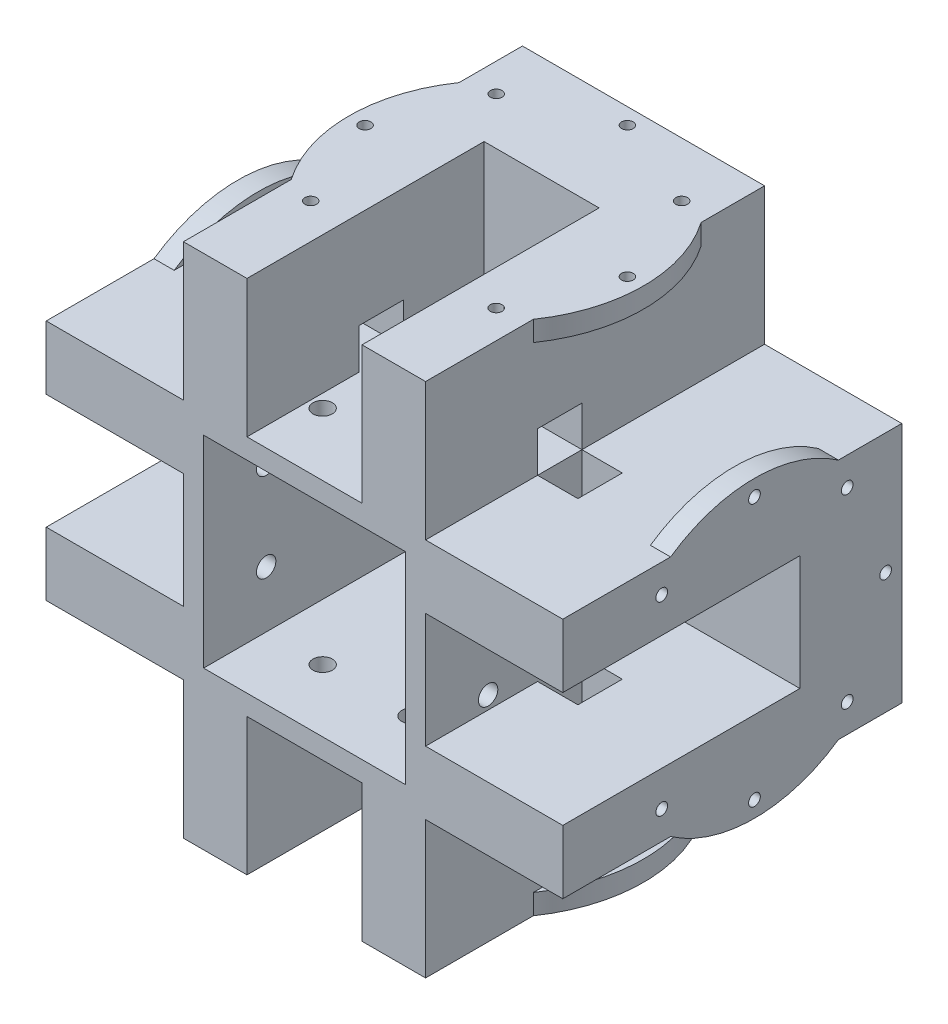
from build123d import *

# Parameters (mm, degrees)
SKETCH_1_W                = 60
SKETCH_1_H                = 60
SKETCH_1_W_2              = 50
SKETCH_1_H_2              = 50
EXTRUDE_1_DEPTH           = 84
EXTRUDE_2_DEPTH           = 34
EXTRUDE_5_DEPTH           = 34
EXTRUDE_6_DEPTH           = 34
EXTRUDE_7_DEPTH           = 34
SKETCH_12_R               = 36.5
EXTRUDE_8_DEPTH           = 5
EXTRUDE_START             = -5
SKETCH_13_R               = 36.5
EXTRUDE_9_DEPTH           = 5
SKETCH_14_R               = 36.5
EXTRUDE_10_DEPTH          = 5
SKETCH_15_R               = 36.5
EXTRUDE_11_DEPTH          = 5
SKETCH_22_W               = 29
SKETCH_22_H               = 28.5
SKETCH_22_W_2             = 28.5
SKETCH_22_H_2             = 29
EXTRUDE_12_DEPTH          = 60
SKETCH_18_R               = 1.45
CUT_EXTRUDE_2_DEPTH       = 5
PATTERN_CIRCULAR_1_COUNT  = 8
SKETCH_19_R               = 1.45
CUT_EXTRUDE_3_DEPTH       = 5
PATTERN_CIRCULAR_2_COUNT  = 8
CUT_EXTRUDE_START         = -5
SKETCH_20_R               = 1.45
CUT_EXTRUDE_4_DEPTH       = 5
PATTERN_CIRCULAR_3_COUNT  = 8
SKETCH_21_R               = 1.45
CUT_EXTRUDE_5_DEPTH       = 5
PATTERN_CIRCULAR_4_COUNT  = 8
SKETCH_26_W               = 34
SKETCH_26_H               = 28.5
SKETCH_26_W_2             = 28.5
SKETCH_26_H_2             = 34
CUT_EXTRUDE_7_DEPTH       = 58.75
SKETCH_27_R               = 10.5
CUT_EXTRUDE_8_DEPTH       = 200
SKETCH_28_R               = 10.5
CUT_EXTRUDE_9_DEPTH       = 200
SKETCH_31_R               = 2.4
CUT_EXTRUDE_12_DEPTH      = 200
SKETCH_32_R               = 2.4
CUT_EXTRUDE_13_DEPTH      = 200
CUT_EXTRUDE_14_DEPTH      = 50
CUT_EXTRUDE_14_DEPTH_BACK = 40
SKETCH_33_W               = 11
SKETCH_33_H               = 10
CUT_EXTRUDE_15_DEPTH      = 60
CUT_EXTRUDE_15_DEPTH_BACK = 40
SKETCH_34_W               = 10
SKETCH_34_H               = 11
SKETCH_35_W               = 11
SKETCH_35_H               = 10
CUT_EXTRUDE_16_DEPTH      = 80
SKETCH_36_W               = 10
SKETCH_36_H               = 11
CUT_EXTRUDE_17_DEPTH      = 80


with BuildPart() as part:
    # 草图1 → 拉伸-薄壁1 (new body)
    with BuildSketch(Plane.XY):
        with Locations((-65.869565217, 24.858695652)):
            Rectangle(SKETCH_1_W, SKETCH_1_H)
        with Locations((-65.869565217, 24.858695652)):
            Rectangle(SKETCH_1_W_2, SKETCH_1_H_2, mode=Mode.SUBTRACT)
    extrude(amount=EXTRUDE_1_DEPTH)

    # 草图5 → 凸台-拉伸2 (add)
    with BuildSketch(Plane(origin=(-35.869565217, 0, 0), x_dir=(0, 0, -1), z_dir=(1, 0, 0))):
        Polygon((0, 54.858695652), (-5, 54.858695652), (-84, 54.858695652), (-84, 39.108695652), (-5, 39.108695652), (-5, 10.608695652), (-84, 10.608695652), (-84, -5.141304348), (-5, -5.141304348), (0, -5.141304348), align=None)
    extrude(amount=EXTRUDE_2_DEPTH)

    # 草图8 → 凸台-拉伸5 (add)
    with BuildSketch(Plane(origin=(0, 54.858695652, 0), x_dir=(1, 0, 0), z_dir=(0, 1, 0))):
        Polygon((-95.869565217, 0), (-35.869565217, 0), (-35.869565217, -5), (-35.869565217, -84), (-51.619565217, -84), (-51.619565217, -5), (-80.119565217, -5), (-80.119565217, -84), (-95.869565217, -84), (-95.869565217, -5), align=None)
    extrude(amount=EXTRUDE_5_DEPTH)

    # 草图9 → 凸台-拉伸6 (add)
    with BuildSketch(Plane.ZY.offset(95.869565217)):
        Polygon((0, -5.141304348), (5, -5.141304348), (84, -5.141304348), (84, 10.608695652), (5, 10.608695652), (5, 39.108695652), (84, 39.108695652), (84, 54.858695652), (5, 54.858695652), (0, 54.858695652), align=None)
    extrude(amount=EXTRUDE_6_DEPTH)

    # 草图10 → 凸台-拉伸7 (add)
    with BuildSketch(Plane(origin=(0, -5.141304348, 0), x_dir=(-1, 0, 0), z_dir=(0, -1, 0))):
        Polygon((95.869565217, 0), (35.869565217, 0), (35.869565217, -6.658214143), (35.869565217, -84), (51.619565217, -84), (51.619565217, -6.658214143), (80.119565217, -6.658214143), (80.119565217, -84), (95.869565217, -84), (95.869565217, -6.658214143), align=None)
    extrude(amount=EXTRUDE_7_DEPTH)

    # 草图12 → 凸台-拉伸8 (add)
    with BuildSketch(Plane.ZY.offset(129.869565217)):
        with Locations((36.5, 24.858695652)):
            Circle(SKETCH_12_R)
    extrude(amount=-EXTRUDE_8_DEPTH)

    # 草图13 → 凸台-拉伸9 (add)
    with BuildSketch(Plane(origin=(-1.869565217, 0, 0), x_dir=(0, 0, -1), z_dir=(1, 0, 0)).offset(EXTRUDE_START)):
        with Locations((-36.5, 24.858695652)):
            Circle(SKETCH_13_R)
    extrude(amount=EXTRUDE_9_DEPTH)

    # 草图14 → 凸台-拉伸10 (add)
    with BuildSketch(Plane(origin=(0, 88.858695652, 0), x_dir=(1, 0, 0), z_dir=(0, 1, 0))):
        with Locations((-65.869565217, -36.5)):
            Circle(SKETCH_14_R)
    extrude(amount=-EXTRUDE_10_DEPTH)

    # 草图15 → 凸台-拉伸11 (add)
    with BuildSketch(Plane(origin=(0, -39.141304348, 0), x_dir=(-1, 0, 0), z_dir=(0, -1, 0)).offset(EXTRUDE_START)):
        with Locations((65.869565217, -36.5)):
            Circle(SKETCH_15_R)
    extrude(amount=EXTRUDE_11_DEPTH)

    # 草图22 → 凸台-拉伸12 (add)
    with BuildSketch(Plane.XY.offset(5)):
        with Locations((-110.369565217, 24.858695652)):
            Rectangle(SKETCH_22_W, SKETCH_22_H)
        with Locations((-65.869565217, 69.358695652)):
            Rectangle(SKETCH_22_W_2, SKETCH_22_H_2)
        with Locations((-21.369565217, 24.858695652)):
            Rectangle(SKETCH_22_W, SKETCH_22_H)
        with Locations((-65.869565217, -19.641304348)):
            Rectangle(SKETCH_22_W_2, SKETCH_22_H_2)
    extrude(amount=EXTRUDE_12_DEPTH)

    # 草图18 → 切除-拉伸2 (cut)
    with BuildSketch(Plane(origin=(0, 88.858695652, 0), x_dir=(1, 0, 0), z_dir=(0, 1, 0))):
        with Locations(Location((-98.369565217, -36.5, 0), (0, 0, 270))):
            Circle(SKETCH_18_R)
    cut_extrude_2 = extrude(amount=-CUT_EXTRUDE_2_DEPTH, mode=Mode.SUBTRACT)

    # 阵列(圆周)1: 切除-拉伸2 ×8 about axis
    pattern_circular_1_axis = Axis((-65.869565217, 0, 36.5), (0, 1, 0))
    for i in range(1, PATTERN_CIRCULAR_1_COUNT):
        add(cut_extrude_2.rotate(pattern_circular_1_axis, i * 360 / PATTERN_CIRCULAR_1_COUNT), mode=Mode.SUBTRACT)

    # 草图19 → 切除-拉伸3 (cut)
    with BuildSketch(Plane(origin=(-1.869565217, 0, 0), x_dir=(0, 0, -1), z_dir=(1, 0, 0))):
        with Locations(Location((-36.5, 57.358695652, 0), (0, 0, 90))):
            Circle(SKETCH_19_R)
    cut_extrude_3 = extrude(amount=-CUT_EXTRUDE_3_DEPTH, mode=Mode.SUBTRACT)

    # 阵列(圆周)2: 切除-拉伸3 ×8 about axis
    pattern_circular_2_axis = Axis((0, 24.858695652, 36.5), (1, 0, 0))
    for i in range(1, PATTERN_CIRCULAR_2_COUNT):
        add(cut_extrude_3.rotate(pattern_circular_2_axis, i * 360 / PATTERN_CIRCULAR_2_COUNT), mode=Mode.SUBTRACT)

    # 草图20 → 切除-拉伸4 (cut)
    with BuildSketch(Plane(origin=(0, -39.141304348, 0), x_dir=(-1, 0, 0), z_dir=(0, -1, 0)).offset(CUT_EXTRUDE_START)):
        with Locations(Location((98.369565217, -36.5, 0), (0, 0, 270))):
            Circle(SKETCH_20_R)
    cut_extrude_4 = extrude(amount=CUT_EXTRUDE_4_DEPTH, mode=Mode.SUBTRACT)

    # 阵列(圆周)3: 切除-拉伸4 ×8 about axis
    pattern_circular_3_axis = Axis((-65.869565217, 0, 36.5), (0, 1, 0))
    for i in range(1, PATTERN_CIRCULAR_3_COUNT):
        add(cut_extrude_4.rotate(pattern_circular_3_axis, i * 360 / PATTERN_CIRCULAR_3_COUNT), mode=Mode.SUBTRACT)

    # 草图21 → 切除-拉伸5 (cut)
    with BuildSketch(Plane.ZY.offset(129.869565217).offset(CUT_EXTRUDE_START)):
        with Locations(Location((36.5, 57.358695652, 0), (0, 0, 90))):
            Circle(SKETCH_21_R)
    cut_extrude_5 = extrude(amount=CUT_EXTRUDE_5_DEPTH, mode=Mode.SUBTRACT)

    # 阵列(圆周)4: 切除-拉伸5 ×8 about axis
    pattern_circular_4_axis = Axis((0, 24.858695652, 36.5), (1, 0, 0))
    for i in range(1, PATTERN_CIRCULAR_4_COUNT):
        add(cut_extrude_5.rotate(pattern_circular_4_axis, i * 360 / PATTERN_CIRCULAR_4_COUNT), mode=Mode.SUBTRACT)

    # 草图26 → 切除-拉伸7 (cut)
    with BuildSketch(Plane.XY.offset(84)):
        with Locations((-112.869565217, 24.858695652)):
            Rectangle(SKETCH_26_W, SKETCH_26_H)
        with Locations((-65.869565217, 71.858695652)):
            Rectangle(SKETCH_26_W_2, SKETCH_26_H_2)
        with Locations((-18.869565217, 24.858695652)):
            Rectangle(SKETCH_26_W, SKETCH_26_H)
        with Locations((-65.869565217, -22.141304348)):
            Rectangle(SKETCH_26_W_2, SKETCH_26_H_2)
    extrude(amount=-CUT_EXTRUDE_7_DEPTH, mode=Mode.SUBTRACT)

    # 草图27 → 切除-拉伸8 (cut)
    with BuildSketch(Plane.ZY.offset(129.869565217)):
        with Locations((36.5, 24.858695652)):
            Circle(SKETCH_27_R)
    extrude(amount=-CUT_EXTRUDE_8_DEPTH, mode=Mode.SUBTRACT)

    # 草图28 → 切除-拉伸9 (cut)
    with BuildSketch(Plane(origin=(0, 88.858695652, 0), x_dir=(1, 0, 0), z_dir=(0, 1, 0))):
        with Locations(Location((-65.869565217, -36.5, 0), (0, 0, 270))):
            Circle(SKETCH_28_R)
    extrude(amount=-CUT_EXTRUDE_9_DEPTH, mode=Mode.SUBTRACT)

    # 草图31 → 切除-拉伸12 (cut)
    with BuildSketch(Plane.ZY.offset(95.869565217)):
        with Locations((28.5, 13.858695652)):
            Circle(SKETCH_31_R)
        with Locations((28.5, 35.858695652)):
            Circle(SKETCH_31_R)
        with Locations((68.5, 35.858695652)):
            Circle(SKETCH_31_R)
        with Locations((68.5, 13.858695652)):
            Circle(SKETCH_31_R)
    extrude(amount=-CUT_EXTRUDE_12_DEPTH, mode=Mode.SUBTRACT)

    # 草图32 → 切除-拉伸13 (cut)
    with BuildSketch(Plane(origin=(0, -5.141304348, 0), x_dir=(-1, 0, 0), z_dir=(0, -1, 0))):
        with Locations(Location((76.869565217, -28.5, 0), (0, 0, 90))):
            Circle(SKETCH_32_R)
        with Locations(Location((54.869565217, -28.5, 0), (0, 0, 90))):
            Circle(SKETCH_32_R)
        with Locations(Location((54.869565217, -68.5, 0), (0, 0, 90))):
            Circle(SKETCH_32_R)
        with Locations(Location((76.869565217, -68.5, 0), (0, 0, 90))):
            Circle(SKETCH_32_R)
    extrude(amount=-CUT_EXTRUDE_13_DEPTH, mode=Mode.SUBTRACT)

    # 草图33 → 切除-拉伸14 (cut, two sides: drawn at the far end of the back side and taken through both)
    with BuildSketch(Plane.ZY.offset(51.619565217).offset(-CUT_EXTRUDE_14_DEPTH_BACK)):
        with Locations((50.75, -10.141304348)):
            Rectangle(SKETCH_33_W, SKETCH_33_H)
    extrude(amount=CUT_EXTRUDE_14_DEPTH + CUT_EXTRUDE_14_DEPTH_BACK, mode=Mode.SUBTRACT)

    # 草图34 → 切除-拉伸15 (cut, two sides: drawn at the far end of the back side and taken through both)
    with BuildSketch(Plane(origin=(0, 10.608695652, 0), x_dir=(1, 0, 0), z_dir=(0, 1, 0)).offset(-CUT_EXTRUDE_15_DEPTH_BACK)):
        with Locations((-100.869565217, -50.75)):
            Rectangle(SKETCH_34_W, SKETCH_34_H)
    extrude(amount=CUT_EXTRUDE_15_DEPTH + CUT_EXTRUDE_15_DEPTH_BACK, mode=Mode.SUBTRACT)

    # 草图35 → 切除-拉伸16 (cut)
    with BuildSketch(Plane.ZY.offset(95.869565217)):
        with Locations((50.75, 59.858695652)):
            Rectangle(SKETCH_35_W, SKETCH_35_H)
    extrude(amount=-CUT_EXTRUDE_16_DEPTH, mode=Mode.SUBTRACT)

    # 草图36 → 切除-拉伸17 (cut)
    with BuildSketch(Plane(origin=(0, 54.858695652, 0), x_dir=(1, 0, 0), z_dir=(0, 1, 0))):
        with Locations((-30.869565217, -50.75)):
            Rectangle(SKETCH_36_W, SKETCH_36_H)
    extrude(amount=-CUT_EXTRUDE_17_DEPTH, mode=Mode.SUBTRACT)


solid = part.part
